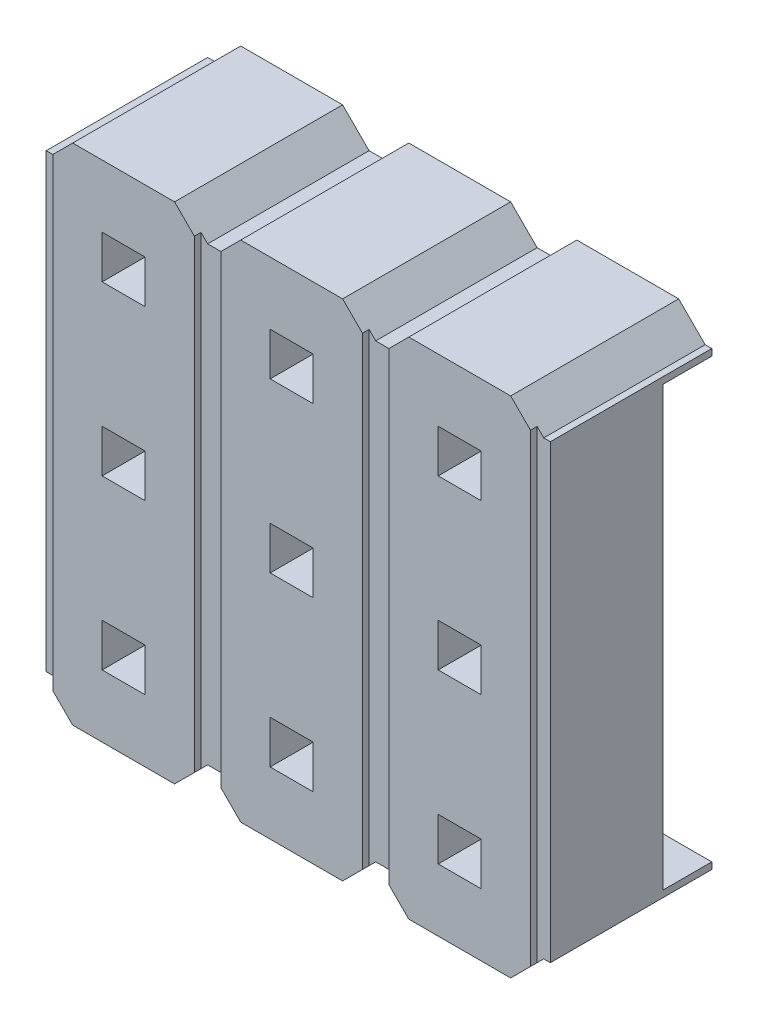
from build123d import *

# Parameters (mm, degrees)
BOSS_EXTRU_1_DEPTH                  = 2.54
ENL_V_MAT_EXTRU_2_DEPTH             = 0.1
ESQUISSE5_W                         = 0.65
ESQUISSE5_H                         = 0.65
ENL_V_MAT_EXTRU_3_DEPTH             = 5.751904881
R_P_TITION_LIN_AIRE1_COUNT          = 3
R_P_TITION_LIN_AIRE1_PITCH          = 2.54
R_P_TITION_LIN_AIRE_COUNT           = 3
R_P_TITION_LIN_AIRE_PITCH           = 2.54
R_P_TITION_LIN_AIRE_COPY_1_SKETCH_W = 0.65
R_P_TITION_LIN_AIRE_COPY_1_SKETCH_H = 0.65
R_P_TITION_LIN_AIRE_COPY_1_DEPTH    = 5.751904881
R_P_TITION_LIN_AIRE_COPY_2_SKETCH_W = 0.65
R_P_TITION_LIN_AIRE_COPY_2_SKETCH_H = 0.65
R_P_TITION_LIN_AIRE_COPY_2_DEPTH    = 5.751904881
R_P_TITION_LIN_AIRE_COPY_3_SKETCH_W = 0.65
R_P_TITION_LIN_AIRE_COPY_3_SKETCH_H = 0.65
R_P_TITION_LIN_AIRE_COPY_3_DEPTH    = 5.751904881
R_P_TITION_LIN_AIRE_COPY_4_SKETCH_W = 0.65
R_P_TITION_LIN_AIRE_COPY_4_SKETCH_H = 0.65
R_P_TITION_LIN_AIRE_COPY_4_DEPTH    = 5.751904881
ESQUISSE2_W                         = 0.74
ESQUISSE2_H                         = 6.62
ENL_V_MAT_EXTRU_1_DEPTH             = 9.89


with BuildPart() as part:
    # Esquisse1 → Boss.-Extru.1 (new body)
    with BuildSketch(Plane.XY):
        Polygon((-1.27, -3.41), (-1.27, 3.41), (-1.17, 3.41), (-0.77, 3.81), (0.77, 3.81), (1.17, 3.41), (1.27, 3.41), (1.27, -3.41), (1.17, -3.41), (0.77, -3.81), (-0.77, -3.81), (-1.17, -3.41), align=None)
    boss_extru_1 = extrude(amount=BOSS_EXTRU_1_DEPTH)

    # Esquisse3 → Enlèv. mat.-Extru.2 (cut)
    with BuildSketch(Plane(origin=(0, 0.04, 2.54), x_dir=(1, 0, 0), z_dir=(0, 0, -1))):
        Polygon((-1.27, -3.37), (-1.17, -3.37), (-1.07, -3.47), (-1.07, 3.55), (-1.17, 3.45), (-1.27, 3.45), align=None)
        Polygon((1.27, 3.45), (1.27, -3.37), (1.17, -3.37), (1.07, -3.47), (1.07, 3.55), (1.17, 3.45), align=None)
    enl_v_mat_extru_2 = extrude(amount=ENL_V_MAT_EXTRU_2_DEPTH, mode=Mode.SUBTRACT)

    # Esquisse5 → Enlèv. mat.-Extru.3 (cut, through all)
    with BuildSketch(Plane.XY.offset(2.54)):
        with Locations((0, -2.54)):
            Rectangle(ESQUISSE5_W, ESQUISSE5_H)
    enl_v_mat_extru_3 = extrude(amount=-ENL_V_MAT_EXTRU_3_DEPTH, mode=Mode.SUBTRACT)

    # Répétition linéaire1: Enlèv. mat.-Extru.3 ×3
    with Locations(*[(0, i * R_P_TITION_LIN_AIRE1_PITCH, 0) for i in range(1, R_P_TITION_LIN_AIRE1_COUNT)]):
        add(enl_v_mat_extru_3, mode=Mode.SUBTRACT)

    # Répétition linéaire: Boss.-Extru.1, Enlèv. mat.-Extru.2, Enlèv. mat.-Extru.3 ×3
    with Locations(*[(i * R_P_TITION_LIN_AIRE_PITCH, 0, 0) for i in range(1, R_P_TITION_LIN_AIRE_COUNT)]):
        add(boss_extru_1)
        add(enl_v_mat_extru_2, mode=Mode.SUBTRACT)
        add(enl_v_mat_extru_3, mode=Mode.SUBTRACT)

    # Répétition linéaire copy 1 sketch → Répétition linéaire copy 1 (cut, through all)
    with BuildSketch(Plane(origin=(2.54, 2.54, 2.54), x_dir=(1, 0, 0), z_dir=(0, 0, 1))):
        with Locations((0, -2.54)):
            Rectangle(R_P_TITION_LIN_AIRE_COPY_1_SKETCH_W, R_P_TITION_LIN_AIRE_COPY_1_SKETCH_H)
    extrude(amount=-R_P_TITION_LIN_AIRE_COPY_1_DEPTH, mode=Mode.SUBTRACT)

    # Répétition linéaire copy 2 sketch → Répétition linéaire copy 2 (cut, through all)
    with BuildSketch(Plane(origin=(5.08, 2.54, 2.54), x_dir=(1, 0, 0), z_dir=(0, 0, 1))):
        with Locations((0, -2.54)):
            Rectangle(R_P_TITION_LIN_AIRE_COPY_2_SKETCH_W, R_P_TITION_LIN_AIRE_COPY_2_SKETCH_H)
    extrude(amount=-R_P_TITION_LIN_AIRE_COPY_2_DEPTH, mode=Mode.SUBTRACT)

    # Répétition linéaire copy 3 sketch → Répétition linéaire copy 3 (cut, through all)
    with BuildSketch(Plane(origin=(2.54, 5.08, 2.54), x_dir=(1, 0, 0), z_dir=(0, 0, 1))):
        with Locations((0, -2.54)):
            Rectangle(R_P_TITION_LIN_AIRE_COPY_3_SKETCH_W, R_P_TITION_LIN_AIRE_COPY_3_SKETCH_H)
    extrude(amount=-R_P_TITION_LIN_AIRE_COPY_3_DEPTH, mode=Mode.SUBTRACT)

    # Répétition linéaire copy 4 sketch → Répétition linéaire copy 4 (cut, through all)
    with BuildSketch(Plane(origin=(5.08, 5.08, 2.54), x_dir=(1, 0, 0), z_dir=(0, 0, 1))):
        with Locations((0, -2.54)):
            Rectangle(R_P_TITION_LIN_AIRE_COPY_4_SKETCH_W, R_P_TITION_LIN_AIRE_COPY_4_SKETCH_H)
    extrude(amount=-R_P_TITION_LIN_AIRE_COPY_4_DEPTH, mode=Mode.SUBTRACT)

    # Esquisse2 → Enlèv. mat.-Extru.1 (cut, through all)
    with BuildSketch(Plane(origin=(-1.27, 0, 0), x_dir=(0, 0, -1), z_dir=(1, 0, 0))):
        with Locations((-0.37, 0)):
            Rectangle(ESQUISSE2_W, ESQUISSE2_H)
    extrude(amount=ENL_V_MAT_EXTRU_1_DEPTH, mode=Mode.SUBTRACT)


solid = part.part
